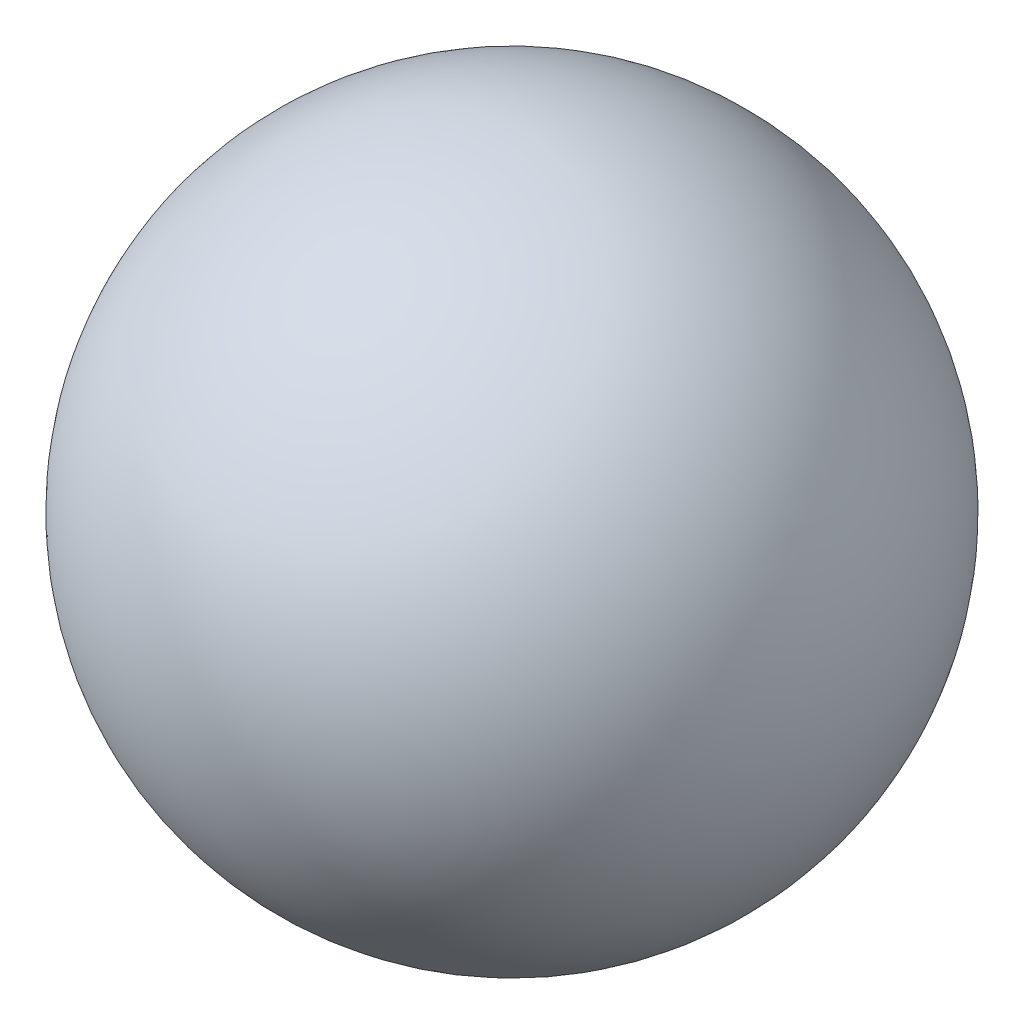
from build123d import *


with BuildPart() as part:
    # Schizzo1 → Rivoluzione1 (revolve)
    with BuildSketch(Plane.XY):
        with BuildLine():
            Line((15.747, 66.25), (2.253, 66.25))
            ThreePointArc((2.253, 66.25), (9, 72.997), (15.747, 66.25))
        make_face()
    revolve(axis=Axis((15.747, 66.25, 0), (-1, 0, 0)))


solid = part.part
